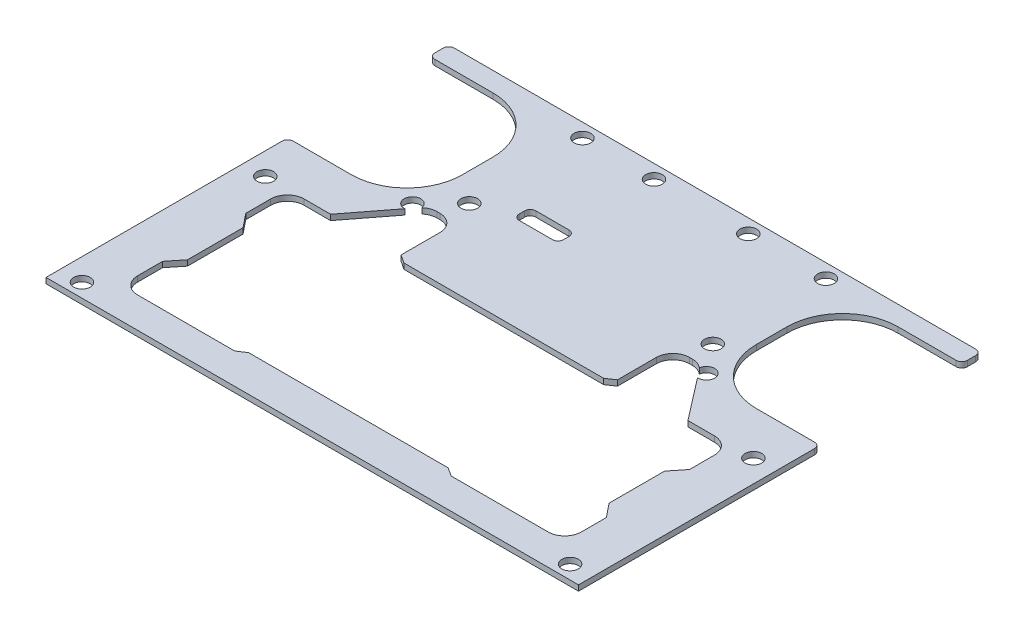
from build123d import *

# Parameters (mm, degrees)
SKETCH_1_R          = 1.5
EXTRUDE_1_DEPTH     = 1
SKETCH_3_R          = 1.5
CUT_EXTRUDE_1_DEPTH = 61.191781662
SKETCH_4_R          = 1.5
CUT_EXTRUDE_2_DEPTH = 61.191781662
CUT_EXTRUDE_3_DEPTH = 61.191781662


with BuildPart() as part:
    # Эскиз1 → Бобышка-Вытянуть1 (new body)
    with BuildSketch(Plane(origin=(0, 0, 0), x_dir=(1, 0, 0), z_dir=(0, 1, 0))):
        with BuildLine():
            Line((-48, -36.304966321), (48, -36.304966321))
            Line((48, -36.304966321), (48, 6.254720986))
            ThreePointArc((48, 6.254720986), (47.707106781, 6.961827767), (47, 7.254720986))
            Line((47, 7.254720986), (36.5, 7.254720986))
            ThreePointArc((36.5, 7.254720986), (29.428932188, 10.183653174), (26.5, 17.254720986))
            Line((26.5, 17.254720986), (26.5, 22.788381883))
            ThreePointArc((26.5, 22.788381883), (29.428932188, 29.859449695), (36.5, 32.788381883))
            Line((36.5, 32.788381883), (47, 32.788381883))
            ThreePointArc((47, 32.788381883), (47.707106781, 33.081275101), (48, 33.788381883))
            Line((48, 33.788381883), (48, 35.304966322))
            ThreePointArc((48, 35.304966322), (47.707106781, 36.012073103), (47, 36.304966322))
            Line((47, 36.304966322), (-47, 36.304966322))
            ThreePointArc((-47, 36.304966322), (-47.707106781, 36.012073103), (-48, 35.304966322))
            Line((-48, 35.304966322), (-48, 33.788381883))
            ThreePointArc((-48, 33.788381883), (-47.707106781, 33.081275101), (-47, 32.788381883))
            Line((-47, 32.788381883), (-36.5, 32.788381883))
            ThreePointArc((-36.5, 32.788381883), (-29.428932188, 29.859449695), (-26.5, 22.788381883))
            Line((-26.5, 22.788381883), (-26.5, 17.254720986))
            ThreePointArc((-26.5, 17.254720986), (-29.428932188, 10.183653174), (-36.5, 7.254720986))
            Line((-36.5, 7.254720986), (-47, 7.254720986))
            ThreePointArc((-47, 7.254720986), (-47.707106781, 6.961827767), (-48, 6.254720986))
            Line((-48, 6.254720986), (-48, -36.304966321))
        make_face()
        with Locations(Location((-21.397134942, 13.404966321, 0), (0, 0, 270))):
            Circle(SKETCH_1_R, mode=Mode.SUBTRACT)
        with Locations(Location((-21.397134942, 33.804966321, 0), (0, 0, 270))):
            Circle(SKETCH_1_R, mode=Mode.SUBTRACT)
        with Locations(Location((22.502865058, 13.404966321, 0), (0, 0, 270))):
            Circle(SKETCH_1_R, mode=Mode.SUBTRACT)
        with Locations(Location((22.502865058, 33.804966321, 0), (0, 0, 270))):
            Circle(SKETCH_1_R, mode=Mode.SUBTRACT)
        with BuildLine():
            Line((-19.5, -0.787211353), (-18, -1.787211353))
            Line((-18, -1.787211353), (18, -1.787211353))
            Line((18, -1.787211353), (19.5, -0.787211353))
            Line((19.5, -0.787211353), (19.5, 6.212788647))
            ThreePointArc((19.5, 6.212788647), (20.378679656, 8.334108991), (22.5, 9.212788647))
            Line((22.5, 9.212788647), (23.024503903, 9.212788647))
            ThreePointArc((23.024503903, 9.212788647), (24.348525199, 8.904807891), (25.400697774, 8.044100386))
            Line((25.400697774, 8.044100386), (32.206912135, -0.787211353))
            Line((32.206912135, -0.787211353), (37, -0.787211353))
            ThreePointArc((37, -0.787211353), (39.121320344, -1.665891009), (40, -3.787211353))
            Line((40, -3.787211353), (40, -8.287211353))
            Line((40, -8.287211353), (38, -10.787211353))
            Line((38, -10.787211353), (38, -20.787211353))
            Line((38, -20.787211353), (40, -23.287211353))
            Line((40, -23.287211353), (40, -27.787211353))
            ThreePointArc((40, -27.787211353), (39.121320344, -29.908531696), (37, -30.787211353))
            Line((37, -30.787211353), (19.5, -30.787211353))
            Line((19.5, -30.787211353), (18, -29.787211353))
            Line((18, -29.787211353), (-18, -29.787211353))
            Line((-18, -29.787211353), (-19.5, -30.787211353))
            Line((-19.5, -30.787211353), (-37, -30.787211353))
            ThreePointArc((-37, -30.787211353), (-39.121320344, -29.908531696), (-40, -27.787211353))
            Line((-40, -27.787211353), (-40, -23.287211353))
            Line((-40, -23.287211353), (-38, -20.787211353))
            Line((-38, -20.787211353), (-38, -10.787211353))
            Line((-38, -10.787211353), (-40, -8.287211353))
            Line((-40, -8.287211353), (-40, -3.787211353))
            ThreePointArc((-40, -3.787211353), (-39.121320344, -1.665891009), (-37, -0.787211353))
            Line((-37, -0.787211353), (-32.206912135, -0.787211353))
            Line((-32.206912135, -0.787211353), (-25.400697774, 8.044100386))
            ThreePointArc((-25.400697774, 8.044100386), (-24.348525199, 8.904807891), (-23.024503903, 9.212788647))
            Line((-23.024503903, 9.212788647), (-22.5, 9.212788647))
            ThreePointArc((-22.5, 9.212788647), (-20.378679656, 8.334108991), (-19.5, 6.212788647))
            Line((-19.5, 6.212788647), (-19.5, -0.787211353))
        make_face(mode=Mode.SUBTRACT)
    extrude(amount=EXTRUDE_1_DEPTH)

    # Эскиз3 → Вырез-Вытянуть1 (cut, through all)
    with BuildSketch(Plane.XZ):
        with Locations(Location((44, 33.82155076, 0), (0, 0, 270))):
            Circle(SKETCH_3_R)
        with Locations(Location((44, 0.766245183, 0), (0, 0, 270))):
            Circle(SKETCH_3_R)
        with Locations(Location((-44, 0.766245183, 0), (0, 0, 270))):
            Circle(SKETCH_3_R)
        with Locations(Location((-44, 33.82155076, 0), (0, 0, 270))):
            Circle(SKETCH_3_R)
    extrude(amount=-CUT_EXTRUDE_1_DEPTH, mode=Mode.SUBTRACT)

    # Эскиз4 → Вырез-Вытянуть2 (cut, through all)
    with BuildSketch(Plane.XZ):
        with Locations((-26.5, -8.260832856)):
            Circle(SKETCH_4_R)
        with Locations(Location((-8.5, -33.804966322, 0), (0, 0, 270))):
            Circle(SKETCH_4_R)
        with Locations(Location((8.5, -33.804966322, 0), (0, 0, 270))):
            Circle(SKETCH_4_R)
        with Locations((26.5, -8.260832856)):
            Circle(SKETCH_4_R)
    extrude(amount=-CUT_EXTRUDE_2_DEPTH, mode=Mode.SUBTRACT)

    # Эскиз6 → Вырез-Вытянуть3 (cut, through all)
    with BuildSketch(Plane(origin=(0, 1, 0), x_dir=(1, 0, 0), z_dir=(0, 1, 0))):
        with BuildLine():
            Line((-14.247312093, 18.245581007), (-8.247312093, 18.245581007))
            ThreePointArc((-8.247312093, 18.245581007), (-7.540205311, 17.952687789), (-7.247312093, 17.245581007))
            Line((-7.247312093, 17.245581007), (-7.247312093, 16.245581007))
            ThreePointArc((-7.247312093, 16.245581007), (-7.540205311, 15.538474226), (-8.247312093, 15.245581007))
            Line((-8.247312093, 15.245581007), (-14.247312093, 15.245581007))
            ThreePointArc((-14.247312093, 15.245581007), (-14.954418874, 15.538474226), (-15.247312093, 16.245581007))
            Line((-15.247312093, 16.245581007), (-15.247312093, 17.245581007))
            ThreePointArc((-15.247312093, 17.245581007), (-14.954418874, 17.952687789), (-14.247312093, 18.245581007))
        make_face()
    extrude(amount=-CUT_EXTRUDE_3_DEPTH, mode=Mode.SUBTRACT)


solid = part.part
